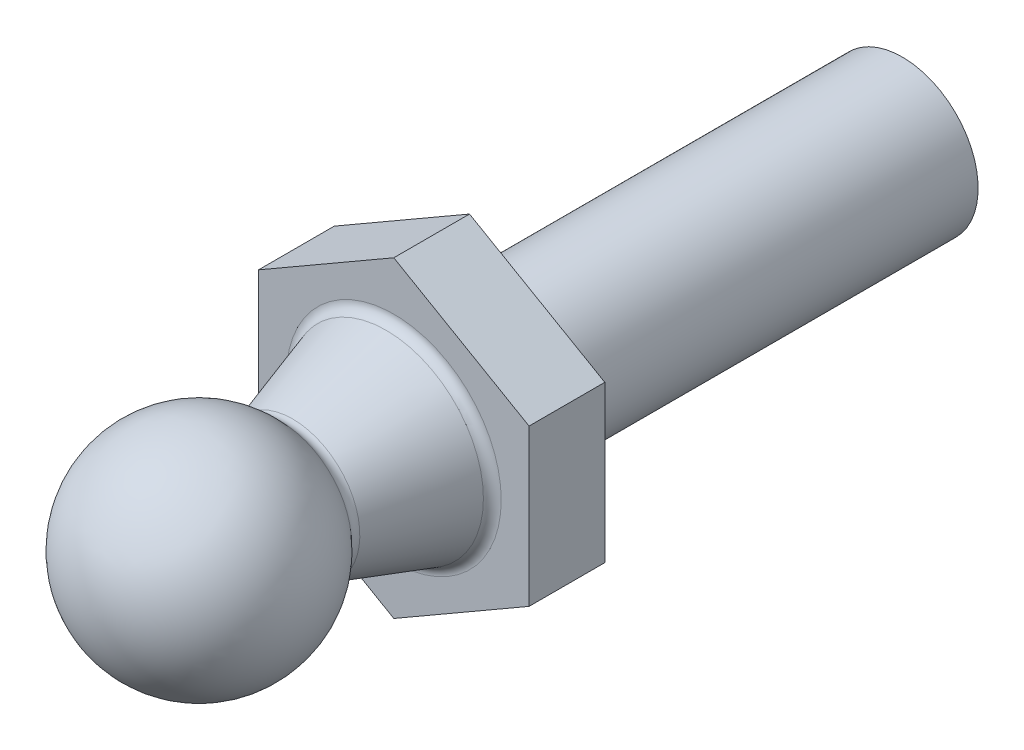
from build123d import *

# Parameters (mm, degrees)
BOSS_EXTRUDE2_DEPTH = 3.5
SKETCH3_R           = 3.5
BOSS_EXTRUDE3_DEPTH = 20
FILLET1_R           = 0.5


with BuildPart() as part:
    # Sketch2 → Boss-Extrude2 (new body)
    with BuildSketch(Plane.XY):
        Polygon((0, 7.216878365), (-6.25, 3.608439182), (-6.25, -3.608439182), (0, -7.216878365), (6.25, -3.608439182), (6.25, 3.608439182), align=None)
    extrude(amount=BOSS_EXTRUDE2_DEPTH)

    # Sketch3 → Boss-Extrude3 (add)
    with BuildSketch(Plane(origin=(0, 0, 0), x_dir=(-1, 0, 0), z_dir=(0, 0, -1))):
        Circle(SKETCH3_R)
    extrude(amount=BOSS_EXTRUDE3_DEPTH)

    # Sketch4 → Revolve1 (revolve)
    with BuildSketch(Plane(origin=(0, 0, 0), x_dir=(0, 0, -1), z_dir=(1, 0, 0))):
        with BuildLine():
            Line((-3.5, 0), (-17.5, 0))
            ThreePointArc((-17.5, 0), (-14.08113883, 4.74341649), (-8.5, 3))
            Line((-8.5, 3), (-3.5, 4.6))
            Line((-3.5, 4.6), (-3.5, 0))
        make_face()
    revolve(axis=Axis((0, 0, 3.5), (0, 0, 1)))

    # Fillet1
    fillet1_edges = [part.edges().sort_by_distance(p)[0] for p in [
        (0, -4.6, 3.5),
        (0, -3, 8.5),
    ]]
    fillet(fillet1_edges, radius=FILLET1_R)


solid = part.part
